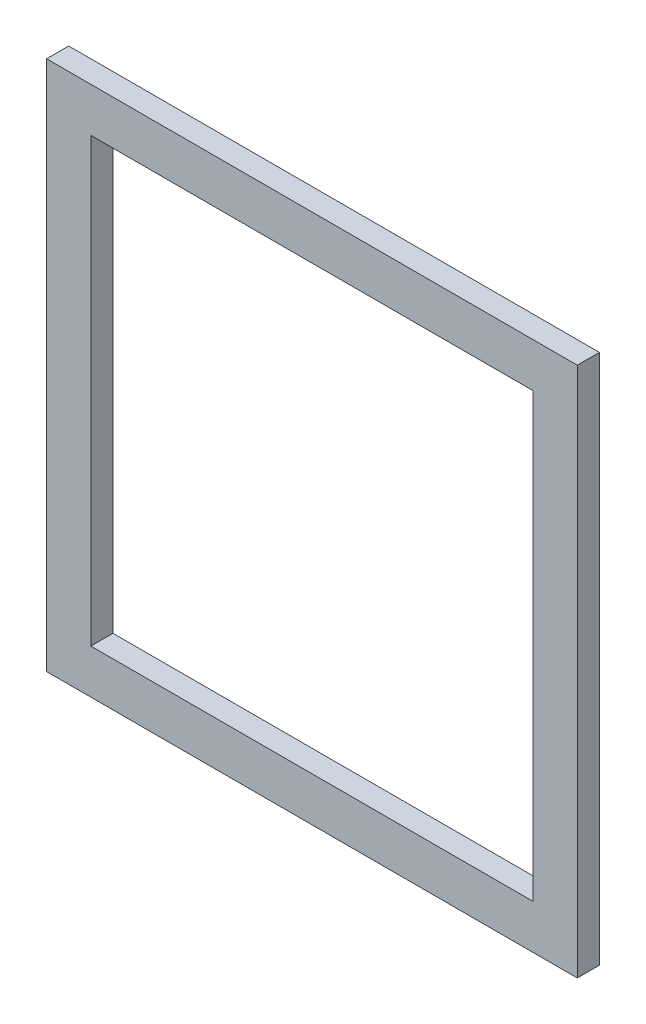
from build123d import *

# Parameters (mm, degrees)
SKETCH1_W           = 76.2
SKETCH1_H           = 76.2
BOSS_EXTRUDE1_DEPTH = 3.175
SKETCH2_W           = 63.5
SKETCH2_H           = 63.5
CUT_EXTRUDE1_DEPTH  = 3.175


with BuildPart() as part:
    # Sketch1 → Boss-Extrude1 (new body)
    with BuildSketch(Plane.XY):
        with Locations((38.1, 38.1)):
            Rectangle(SKETCH1_W, SKETCH1_H)
    extrude(amount=BOSS_EXTRUDE1_DEPTH)

    # Sketch2 → Cut-Extrude1 (cut)
    with BuildSketch(Plane.XY.offset(3.175)):
        with Locations((38.1, 38.1)):
            Rectangle(SKETCH2_W, SKETCH2_H)
    extrude(amount=-CUT_EXTRUDE1_DEPTH, mode=Mode.SUBTRACT)


solid = part.part
